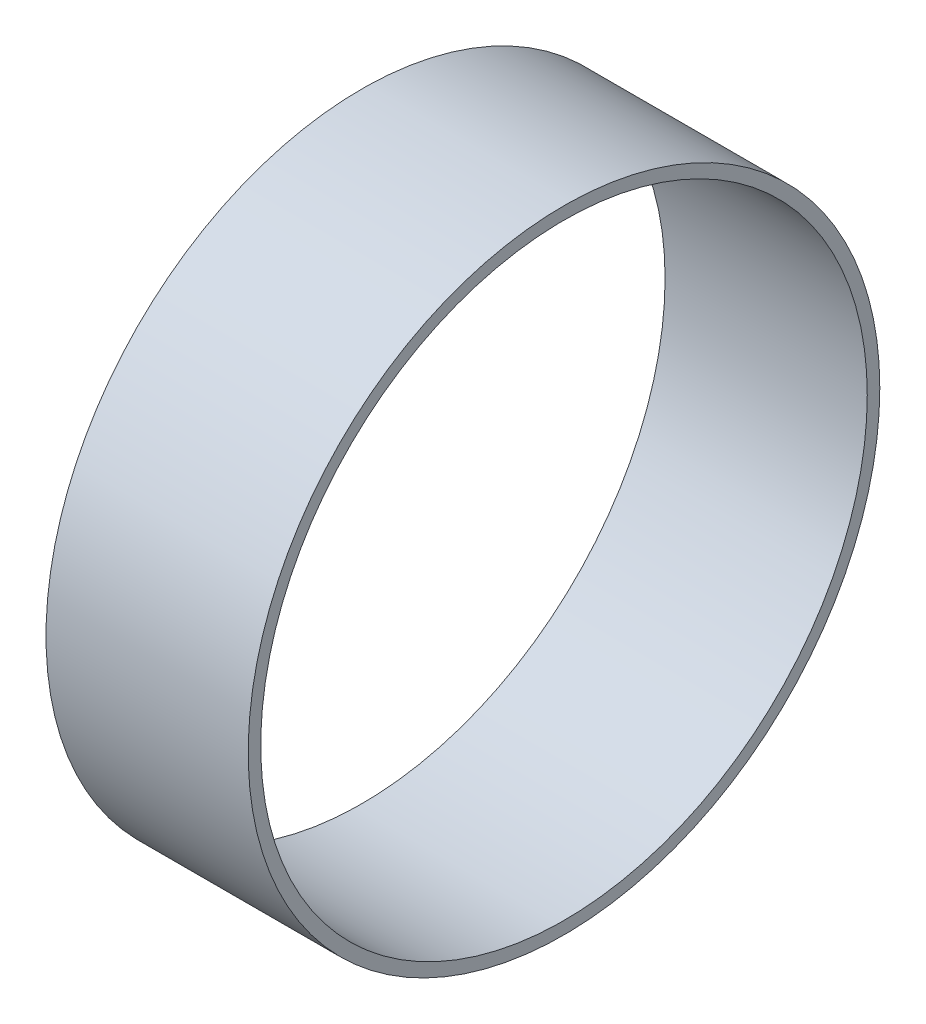
from build123d import *

# Parameters (mm, degrees)
SKETCH1_R           = 39.6748
SKETCH1_R_2         = 38.1
BOSS_EXTRUDE1_DEPTH = 25.4


with BuildPart() as part:
    # Sketch1 → Boss-Extrude1 (new body)
    with BuildSketch(Plane(origin=(0, 0, 0), x_dir=(0, 0, -1), z_dir=(1, 0, 0))):
        Circle(SKETCH1_R)
        Circle(SKETCH1_R_2, mode=Mode.SUBTRACT)
    extrude(amount=BOSS_EXTRUDE1_DEPTH)


solid = part.part
